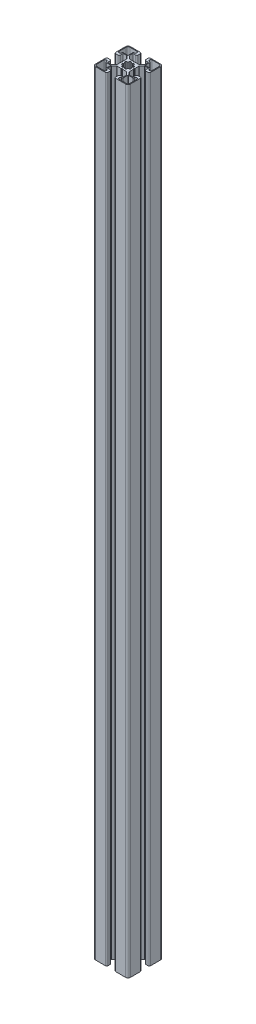
from build123d import *

# Parameters (mm, degrees)
EXTRUDE1_DEPTH = 1000


with BuildPart() as part:
    # Sketch1 → Extrude1 (new body)
    with BuildSketch(Plane(origin=(0, 0, 0), x_dir=(1, 0, 0), z_dir=(0, 1, 0))):
        with BuildLine():
            Line((4.905816029, 11.21531926), (4.005816103, 10.700171216))
            Line((4.005816103, 10.700171216), (3.105816176, 11.21531926))
            Line((3.105816176, 11.21531926), (-2.197508215, 11.21531926))
            ThreePointArc((-2.197508215, 11.21531926), (-2.342927919, 11.244245037), (-2.466208792, 11.326618683))
            Line((-2.466208792, 11.326618683), (-5.932884474, 14.793294365))
            ThreePointArc((-5.932884474, 14.793294365), (-6.01525812, 14.916575238), (-6.044183897, 15.061994942))
            Line((-6.044183897, 15.061994942), (-6.044183897, 19.35531926))
            ThreePointArc((-6.044183897, 19.35531926), (-5.932884474, 19.624019836), (-5.664183897, 19.73531926))
            Line((-5.664183897, 19.73531926), (-2.579183897, 19.73531926))
            ThreePointArc((-2.579183897, 19.73531926), (-1.50438159, 20.180516952), (-1.059183897, 21.25531926))
            Line((-1.059183897, 21.25531926), (-1.059183897, 24.21531926))
            ThreePointArc((-1.059183897, 24.21531926), (-1.50438159, 25.290121567), (-2.579183897, 25.73531926))
            Line((-2.579183897, 25.73531926), (-15.494183897, 25.73531926))
            ThreePointArc((-15.494183897, 25.73531926), (-17.615504241, 24.856639603), (-18.494183897, 22.73531926))
            Line((-18.494183897, 22.73531926), (-18.494183897, 9.82031926))
            ThreePointArc((-18.494183897, 9.82031926), (-18.048986205, 8.745516952), (-16.974183897, 8.30031926))
            Line((-16.974183897, 8.30031926), (-14.014183897, 8.30031926))
            ThreePointArc((-14.014183897, 8.30031926), (-12.93938159, 8.745516952), (-12.494183897, 9.82031926))
            Line((-12.494183897, 9.82031926), (-12.494183897, 12.90531926))
            ThreePointArc((-12.494183897, 12.90531926), (-12.382884474, 13.174019836), (-12.114183897, 13.28531926))
            Line((-12.114183897, 13.28531926), (-7.813788512, 13.28531926))
            ThreePointArc((-7.813788512, 13.28531926), (-7.668368808, 13.256393482), (-7.545087935, 13.174019836))
            Line((-7.545087935, 13.174019836), (-4.08548332, 9.714415222))
            ThreePointArc((-4.08548332, 9.714415222), (-4.003109675, 9.591134349), (-3.974183897, 9.445714645))
            Line((-3.974183897, 9.445714645), (-3.974183897, 4.135318895))
            Line((-3.974183897, 4.135318895), (-3.454570628, 3.23531926))
            Line((-3.454570628, 3.23531926), (-3.974183897, 2.335319624))
            Line((-3.974183897, 2.335319624), (-3.974183897, -2.968005058))
            ThreePointArc((-3.974183897, -2.968005058), (-4.003109675, -3.113424762), (-4.08548332, -3.236705635))
            Line((-4.08548332, -3.236705635), (-7.552159003, -6.703381317))
            ThreePointArc((-7.552159003, -6.703381317), (-7.675439876, -6.785754963), (-7.82085958, -6.81468074))
            Line((-7.82085958, -6.81468074), (-12.114183897, -6.81468074))
            ThreePointArc((-12.114183897, -6.81468074), (-12.382884474, -6.703381317), (-12.494183897, -6.43468074))
            Line((-12.494183897, -6.43468074), (-12.494183897, -3.34968074))
            ThreePointArc((-12.494183897, -3.34968074), (-12.93938159, -2.274878433), (-14.014183897, -1.82968074))
            Line((-14.014183897, -1.82968074), (-16.974183897, -1.82968074))
            ThreePointArc((-16.974183897, -1.82968074), (-18.048986205, -2.274878433), (-18.494183897, -3.34968074))
            Line((-18.494183897, -3.34968074), (-18.494183897, -16.26468074))
            ThreePointArc((-18.494183897, -16.26468074), (-17.615504241, -18.386001084), (-15.494183897, -19.26468074))
            Line((-15.494183897, -19.26468074), (-2.579183897, -19.26468074))
            ThreePointArc((-2.579183897, -19.26468074), (-1.50438159, -18.819483048), (-1.059183897, -17.74468074))
            Line((-1.059183897, -17.74468074), (-1.059183897, -14.78468074))
            ThreePointArc((-1.059183897, -14.78468074), (-1.50438159, -13.709878433), (-2.579183897, -13.26468074))
            Line((-2.579183897, -13.26468074), (-5.664183897, -13.26468074))
            ThreePointArc((-5.664183897, -13.26468074), (-5.932884474, -13.153381317), (-6.044183897, -12.88468074))
            Line((-6.044183897, -12.88468074), (-6.044183897, -8.584285355))
            ThreePointArc((-6.044183897, -8.584285355), (-6.01525812, -8.438865651), (-5.932884474, -8.315584778))
            Line((-5.932884474, -8.315584778), (-2.473279859, -4.855980164))
            ThreePointArc((-2.473279859, -4.855980164), (-2.349998987, -4.773606518), (-2.204579283, -4.74468074))
            Line((-2.204579283, -4.74468074), (3.105816176, -4.74468074))
            Line((3.105816176, -4.74468074), (4.005816103, -4.229532697))
            Line((4.005816103, -4.229532697), (4.905816029, -4.74468074))
            Line((4.905816029, -4.74468074), (10.20914042, -4.74468074))
            ThreePointArc((10.20914042, -4.74468074), (10.354560124, -4.773606518), (10.477840997, -4.855980164))
            Line((10.477840997, -4.855980164), (13.94451668, -8.322655846))
            ThreePointArc((13.94451668, -8.322655846), (14.026890325, -8.445936719), (14.055816103, -8.591356423))
            Line((14.055816103, -8.591356423), (14.055816103, -12.88468074))
            ThreePointArc((14.055816103, -12.88468074), (13.94451668, -13.153381317), (13.675816103, -13.26468074))
            Line((13.675816103, -13.26468074), (10.590816103, -13.26468074))
            ThreePointArc((10.590816103, -13.26468074), (9.516013795, -13.709878433), (9.070816103, -14.78468074))
            Line((9.070816103, -14.78468074), (9.070816103, -17.74468074))
            ThreePointArc((9.070816103, -17.74468074), (9.516013795, -18.819483048), (10.590816103, -19.26468074))
            Line((10.590816103, -19.26468074), (23.505816103, -19.26468074))
            ThreePointArc((23.505816103, -19.26468074), (25.627136446, -18.386001084), (26.505816103, -16.26468074))
            Line((26.505816103, -16.26468074), (26.505816103, -3.34968074))
            ThreePointArc((26.505816103, -3.34968074), (26.06061841, -2.274878433), (24.985816103, -1.82968074))
            Line((24.985816103, -1.82968074), (22.025816103, -1.82968074))
            ThreePointArc((22.025816103, -1.82968074), (20.951013795, -2.274878433), (20.505816103, -3.34968074))
            Line((20.505816103, -3.34968074), (20.505816103, -6.43468074))
            ThreePointArc((20.505816103, -6.43468074), (20.39451668, -6.703381317), (20.125816103, -6.81468074))
            Line((20.125816103, -6.81468074), (15.825420717, -6.81468074))
            ThreePointArc((15.825420717, -6.81468074), (15.680001013, -6.785754963), (15.556720141, -6.703381317))
            Line((15.556720141, -6.703381317), (12.097115526, -3.243776702))
            ThreePointArc((12.097115526, -3.243776702), (12.01474188, -3.12049583), (11.985816103, -2.975076126))
            Line((11.985816103, -2.975076126), (11.985816103, 2.335319624))
            Line((11.985816103, 2.335319624), (11.466202833, 3.23531926))
            Line((11.466202833, 3.23531926), (11.985816103, 4.135318895))
            Line((11.985816103, 4.135318895), (11.985816103, 9.438643577))
            ThreePointArc((11.985816103, 9.438643577), (12.01474188, 9.584063281), (12.097115526, 9.707344154))
            Line((12.097115526, 9.707344154), (15.563791208, 13.174019836))
            ThreePointArc((15.563791208, 13.174019836), (15.687072081, 13.256393482), (15.832491785, 13.28531926))
            Line((15.832491785, 13.28531926), (20.125816103, 13.28531926))
            ThreePointArc((20.125816103, 13.28531926), (20.39451668, 13.174019836), (20.505816103, 12.90531926))
            Line((20.505816103, 12.90531926), (20.505816103, 9.82031926))
            ThreePointArc((20.505816103, 9.82031926), (20.951013795, 8.745516952), (22.025816103, 8.30031926))
            Line((22.025816103, 8.30031926), (24.985816103, 8.30031926))
            ThreePointArc((24.985816103, 8.30031926), (26.06061841, 8.745516952), (26.505816103, 9.82031926))
            Line((26.505816103, 9.82031926), (26.505816103, 22.73531926))
            ThreePointArc((26.505816103, 22.73531926), (25.627136446, 24.856639603), (23.505816103, 25.73531926))
            Line((23.505816103, 25.73531926), (10.590816103, 25.73531926))
            ThreePointArc((10.590816103, 25.73531926), (9.516013795, 25.290121567), (9.070816103, 24.21531926))
            Line((9.070816103, 24.21531926), (9.070816103, 21.25531926))
            ThreePointArc((9.070816103, 21.25531926), (9.516013795, 20.180516952), (10.590816103, 19.73531926))
            Line((10.590816103, 19.73531926), (13.675816103, 19.73531926))
            ThreePointArc((13.675816103, 19.73531926), (13.94451668, 19.624019836), (14.055816103, 19.35531926))
            Line((14.055816103, 19.35531926), (14.055816103, 15.054923874))
            ThreePointArc((14.055816103, 15.054923874), (14.026890325, 14.90950417), (13.94451668, 14.786223298))
            Line((13.94451668, 14.786223298), (10.484912065, 11.326618683))
            ThreePointArc((10.484912065, 11.326618683), (10.361631192, 11.244245037), (10.216211488, 11.21531926))
            Line((10.216211488, 11.21531926), (4.905816029, 11.21531926))
        make_face()
        with BuildLine():
            Line((13.969837884, 21.274341041), (13.529837884, 21.274341041))
            ThreePointArc((13.529837884, 21.274341041), (12.469177713, 21.713680869), (12.029837884, 22.774341041))
            Line((12.029837884, 22.774341041), (12.029837884, 23.274341041))
            ThreePointArc((12.029837884, 23.274341041), (12.469177713, 24.335001213), (13.529837884, 24.774341041))
            Line((13.529837884, 24.774341041), (23.139837884, 24.774341041))
            ThreePointArc((23.139837884, 24.774341041), (24.752041345, 24.106544502), (25.419837884, 22.494341041))
            Line((25.419837884, 22.494341041), (25.419837884, 12.884341041))
            ThreePointArc((25.419837884, 12.884341041), (24.980498056, 11.823680869), (23.919837884, 11.384341041))
            Line((23.919837884, 11.384341041), (23.419837884, 11.384341041))
            ThreePointArc((23.419837884, 11.384341041), (22.359177713, 11.823680869), (21.919837884, 12.884341041))
            Line((21.919837884, 12.884341041), (21.919837884, 13.324341041))
            ThreePointArc((21.919837884, 13.324341041), (21.626944666, 14.031447822), (20.919837884, 14.324341041))
            Line((20.919837884, 14.324341041), (15.349837884, 14.324341041))
            ThreePointArc((15.349837884, 14.324341041), (15.081137307, 14.435640464), (14.969837884, 14.704341041))
            Line((14.969837884, 14.704341041), (14.969837884, 20.274341041))
            ThreePointArc((14.969837884, 20.274341041), (14.676944666, 20.981447822), (13.969837884, 21.274341041))
        make_face(mode=Mode.SUBTRACT)
        with BuildLine():
            Line((21.958859666, -6.68968074), (21.958859666, -6.24968074))
            ThreePointArc((21.958859666, -6.24968074), (22.398199494, -5.189020569), (23.458859666, -4.74968074))
            Line((23.458859666, -4.74968074), (23.958859666, -4.74968074))
            ThreePointArc((23.958859666, -4.74968074), (25.019519838, -5.189020569), (25.458859666, -6.24968074))
            Line((25.458859666, -6.24968074), (25.458859666, -15.85968074))
            ThreePointArc((25.458859666, -15.85968074), (24.791063127, -17.471884201), (23.178859666, -18.13968074))
            Line((23.178859666, -18.13968074), (13.568859666, -18.13968074))
            ThreePointArc((13.568859666, -18.13968074), (12.508199494, -17.700340912), (12.068859666, -16.63968074))
            Line((12.068859666, -16.63968074), (12.068859666, -16.13968074))
            ThreePointArc((12.068859666, -16.13968074), (12.508199494, -15.079020569), (13.568859666, -14.63968074))
            Line((13.568859666, -14.63968074), (14.008859666, -14.63968074))
            ThreePointArc((14.008859666, -14.63968074), (14.715966447, -14.346787522), (15.008859666, -13.63968074))
            Line((15.008859666, -13.63968074), (15.008859666, -8.06968074))
            ThreePointArc((15.008859666, -8.06968074), (15.120159089, -7.800980164), (15.388859666, -7.68968074))
            Line((15.388859666, -7.68968074), (20.958859666, -7.68968074))
            ThreePointArc((20.958859666, -7.68968074), (21.665966447, -7.396787522), (21.958859666, -6.68968074))
        make_face(mode=Mode.SUBTRACT)
        with BuildLine():
            Line((-6.005162116, -14.678702522), (-5.565162116, -14.678702522))
            ThreePointArc((-5.565162116, -14.678702522), (-4.504501944, -15.11804235), (-4.065162116, -16.178702522))
            Line((-4.065162116, -16.178702522), (-4.065162116, -16.678702522))
            ThreePointArc((-4.065162116, -16.678702522), (-4.504501944, -17.739362694), (-5.565162116, -18.178702522))
            Line((-5.565162116, -18.178702522), (-15.175162116, -18.178702522))
            ThreePointArc((-15.175162116, -18.178702522), (-16.787365577, -17.510905983), (-17.455162116, -15.898702522))
            Line((-17.455162116, -15.898702522), (-17.455162116, -6.288702522))
            ThreePointArc((-17.455162116, -6.288702522), (-17.015822287, -5.22804235), (-15.955162116, -4.788702522))
            Line((-15.955162116, -4.788702522), (-15.455162116, -4.788702522))
            ThreePointArc((-15.455162116, -4.788702522), (-14.394501944, -5.22804235), (-13.955162116, -6.288702522))
            Line((-13.955162116, -6.288702522), (-13.955162116, -6.728702522))
            ThreePointArc((-13.955162116, -6.728702522), (-13.662268897, -7.435809303), (-12.955162116, -7.728702522))
            Line((-12.955162116, -7.728702522), (-7.385162116, -7.728702522))
            ThreePointArc((-7.385162116, -7.728702522), (-7.116461539, -7.840001945), (-7.005162116, -8.108702522))
            Line((-7.005162116, -8.108702522), (-7.005162116, -13.678702522))
            ThreePointArc((-7.005162116, -13.678702522), (-6.712268897, -14.385809303), (-6.005162116, -14.678702522))
        make_face(mode=Mode.SUBTRACT)
        with BuildLine():
            Line((1.828915922, -2.488564034), (1.413170132, -2.316356489))
            ThreePointArc((1.413170132, -2.316356489), (0.823336155, -1.625307126), (1.036269925, -0.742067321))
            ThreePointArc((1.036269925, -0.742067321), (0.446703204, -0.237613869), (-0.057716637, 0.351981608))
            ThreePointArc((-0.057716637, 0.351981608), (-0.940937171, 0.139101897), (-1.631952253, 0.728927667))
            Line((-1.631952253, 0.728927667), (-1.804159798, 1.144673456))
            ThreePointArc((-1.804159798, 1.144673456), (-1.732589712, 2.050394753), (-0.957477943, 2.524372695))
            ThreePointArc((-0.957477943, 2.524372695), (-1.017662114, 3.297961778), (-0.957433843, 4.071547428))
            ThreePointArc((-0.957433843, 4.071547428), (-1.73249376, 4.54554997), (-1.804045409, 5.451241222))
            Line((-1.804045409, 5.451241222), (-1.631837865, 5.866987012))
            ThreePointArc((-1.631837865, 5.866987012), (-0.940788501, 6.456820989), (-0.057548696, 6.243887219))
            ThreePointArc((-0.057548696, 6.243887219), (0.446904755, 6.83345394), (1.036500233, 7.33787378))
            ThreePointArc((1.036500233, 7.33787378), (0.823620522, 8.221094315), (1.413446291, 8.912109397))
            Line((1.413446291, 8.912109397), (1.829192081, 9.084316942))
            ThreePointArc((1.829192081, 9.084316942), (2.734913377, 9.012746856), (3.20889132, 8.237635087))
            ThreePointArc((3.20889132, 8.237635087), (3.982480402, 8.297819258), (4.756066053, 8.237590987))
            ThreePointArc((4.756066053, 8.237590987), (5.230068594, 9.012650904), (6.135759847, 9.084202553))
            Line((6.135759847, 9.084202553), (6.551505636, 8.911995008))
            ThreePointArc((6.551505636, 8.911995008), (7.141339614, 8.220945645), (6.928405843, 7.33770584))
            ThreePointArc((6.928405843, 7.33770584), (7.517972564, 6.833252389), (8.022392405, 6.243656911))
            ThreePointArc((8.022392405, 6.243656911), (8.905612939, 6.456536622), (9.596628022, 5.866710852))
            Line((9.596628022, 5.866710852), (9.768835567, 5.450965063))
            ThreePointArc((9.768835567, 5.450965063), (9.697265481, 4.545243766), (8.922153712, 4.071265824))
            ThreePointArc((8.922153712, 4.071265824), (8.982337882, 3.297676741), (8.922109612, 2.524091091))
            ThreePointArc((8.922109612, 2.524091091), (9.697169528, 2.05008855), (9.768721178, 1.144397297))
            Line((9.768721178, 1.144397297), (9.596513633, 0.728651507))
            ThreePointArc((9.596513633, 0.728651507), (8.90546427, 0.13881753), (8.022224464, 0.351751301))
            ThreePointArc((8.022224464, 0.351751301), (7.517771013, -0.23781542), (6.928175536, -0.742235261))
            ThreePointArc((6.928175536, -0.742235261), (7.141055247, -1.625455795), (6.551229477, -2.316470878))
            Line((6.551229477, -2.316470878), (6.135483688, -2.488678423))
            ThreePointArc((6.135483688, -2.488678423), (5.229762391, -2.417108337), (4.755784449, -1.641996568))
            ThreePointArc((4.755784449, -1.641996568), (3.982195366, -1.702180738), (3.208609716, -1.641952468))
            ThreePointArc((3.208609716, -1.641952468), (2.734607174, -2.417012384), (1.828915922, -2.488564034))
        make_face(mode=Mode.SUBTRACT)
        with BuildLine():
            Line((-13.994183897, 13.28531926), (-13.994183897, 12.84531926))
            ThreePointArc((-13.994183897, 12.84531926), (-14.433523726, 11.784659088), (-15.494183897, 11.34531926))
            Line((-15.494183897, 11.34531926), (-15.994183897, 11.34531926))
            ThreePointArc((-15.994183897, 11.34531926), (-17.054844069, 11.784659088), (-17.494183897, 12.84531926))
            Line((-17.494183897, 12.84531926), (-17.494183897, 22.45531926))
            ThreePointArc((-17.494183897, 22.45531926), (-16.826387358, 24.067522721), (-15.214183897, 24.73531926))
            Line((-15.214183897, 24.73531926), (-5.604183897, 24.73531926))
            ThreePointArc((-5.604183897, 24.73531926), (-4.543523726, 24.295979431), (-4.104183897, 23.23531926))
            Line((-4.104183897, 23.23531926), (-4.104183897, 22.73531926))
            ThreePointArc((-4.104183897, 22.73531926), (-4.543523726, 21.674659088), (-5.604183897, 21.23531926))
            Line((-5.604183897, 21.23531926), (-6.044183897, 21.23531926))
            ThreePointArc((-6.044183897, 21.23531926), (-6.751290679, 20.942426041), (-7.044183897, 20.23531926))
            Line((-7.044183897, 20.23531926), (-7.044183897, 14.66531926))
            ThreePointArc((-7.044183897, 14.66531926), (-7.15548332, 14.396618683), (-7.424183897, 14.28531926))
            Line((-7.424183897, 14.28531926), (-12.994183897, 14.28531926))
            ThreePointArc((-12.994183897, 14.28531926), (-13.701290679, 13.992426041), (-13.994183897, 13.28531926))
        make_face(mode=Mode.SUBTRACT)
    extrude(amount=EXTRUDE1_DEPTH)


solid = part.part
